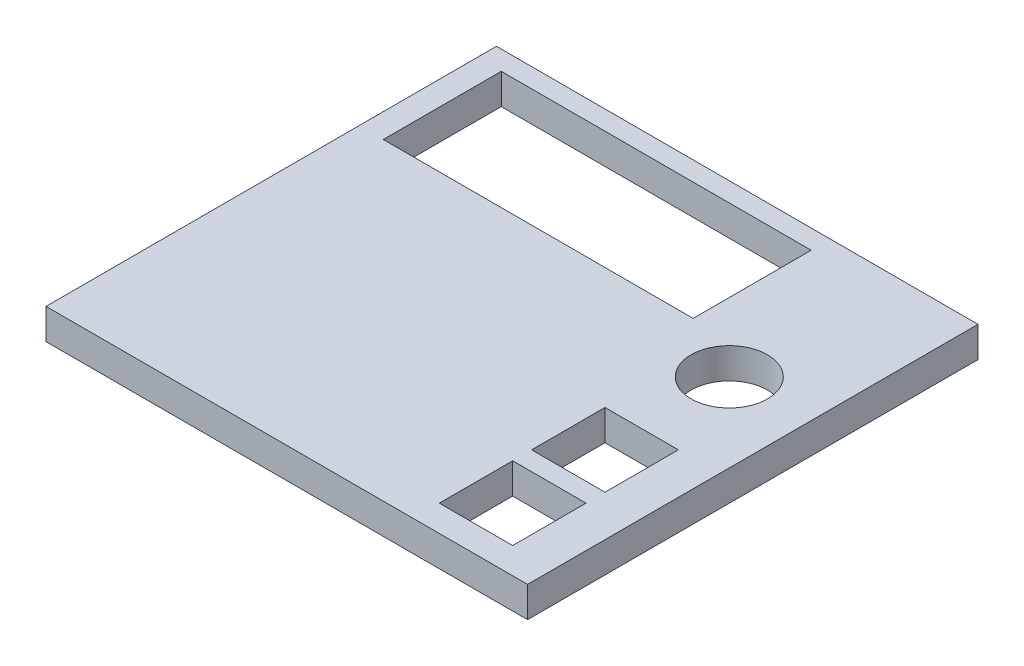
from build123d import *

# Parameters (mm, degrees)
SKETCH1_W           = 78.74
SKETCH1_H           = 73.66
SKETCH1_R           = 6.25
SKETCH1_W_2         = 50.67
SKETCH1_H_2         = 19.3
SKETCH1_W_3         = 12
SKETCH1_H_3         = 12
BOSS_EXTRUDE1_DEPTH = 5


with BuildPart() as part:
    # Sketch1 → Boss-Extrude1 (new body)
    with BuildSketch(Plane(origin=(0, 0, 0), x_dir=(1, 0, 0), z_dir=(0, 1, 0))):
        with Locations((8.206850447, -27.291358184)):
            Rectangle(SKETCH1_W, SKETCH1_H)
        with Locations(Location((34.676850447, -18.233358184, 0), (0, 0, 270))):
            Circle(SKETCH1_R, mode=Mode.SUBTRACT)
        with Locations((-1.888149553, -3.261358184)):
            Rectangle(SKETCH1_W_2, SKETCH1_H_2, mode=Mode.SUBTRACT)
        with Locations((34.857850447, -38.733358184)):
            Rectangle(SKETCH1_W_3, SKETCH1_H_3, mode=Mode.SUBTRACT)
        with Locations((34.857850447, -53.833358184)):
            Rectangle(SKETCH1_W_3, SKETCH1_H_3, mode=Mode.SUBTRACT)
    extrude(amount=BOSS_EXTRUDE1_DEPTH)


solid = part.part
